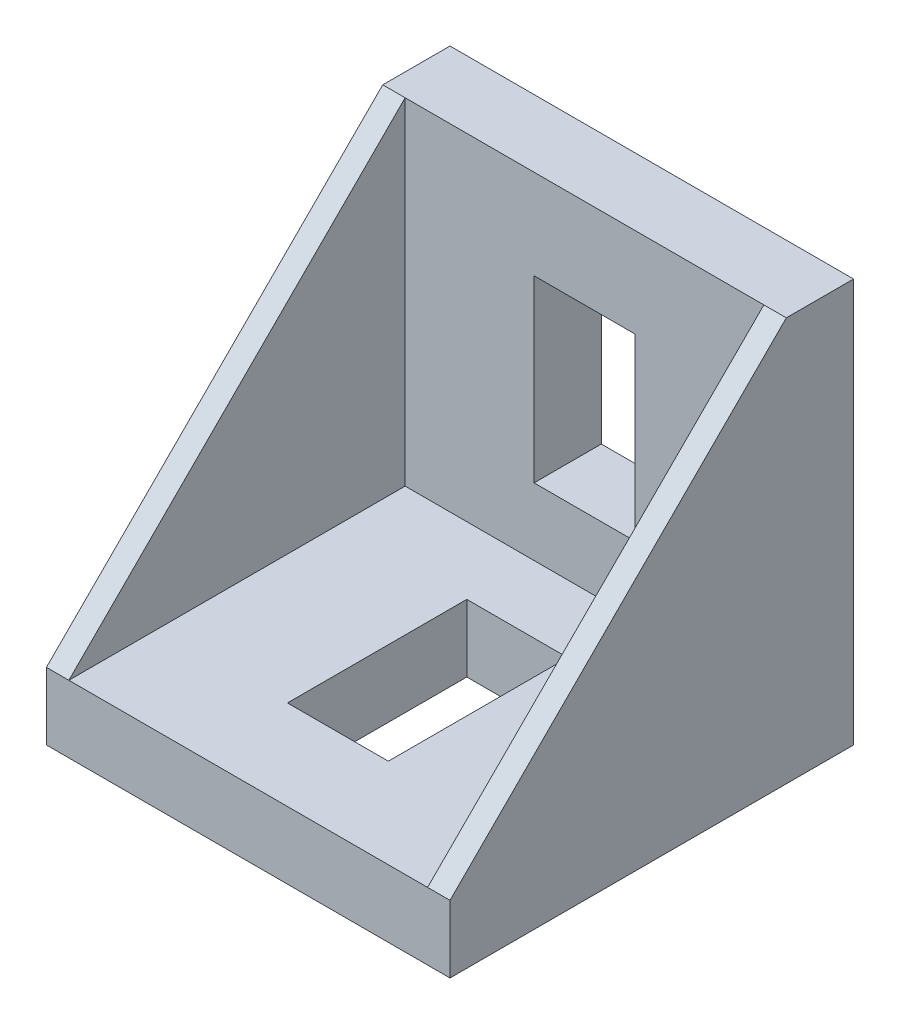
from build123d import *

# Parameters (mm, degrees)
SKETCH1_W           = 18
SKETCH1_H           = 18
BOSS_EXTRUDE1_DEPTH = 3
SKETCH3_W           = 4.5
SKETCH3_H           = 8
CUT_EXTRUDE1_DEPTH  = 14.076696831
SKETCH6_W           = 18
SKETCH6_H           = 3
BOSS_EXTRUDE3_DEPTH = 15
SKETCH7_W           = 4.5
SKETCH7_H           = 8
CUT_EXTRUDE2_DEPTH  = 28
BOSS_EXTRUDE4_DEPTH = 1
CUT_EXTRUDE3_REACH  = 24.045
SKETCH10_W          = 4.5
SKETCH10_H          = 8


with BuildPart() as part:
    # Sketch1 → Boss-Extrude1 (new body)
    with BuildSketch(Plane(origin=(0, 0, 0), x_dir=(1, 0, 0), z_dir=(0, 1, 0))):
        Rectangle(SKETCH1_W, SKETCH1_H)
    boss_extrude1 = extrude(amount=BOSS_EXTRUDE1_DEPTH)

    # Sketch3 → Cut-Extrude1 (cut, through all)
    with BuildSketch(Plane.XZ):
        with Locations((0, 1)):
            Rectangle(SKETCH3_W, SKETCH3_H)
    extrude(amount=-CUT_EXTRUDE1_DEPTH, mode=Mode.SUBTRACT)

    # Sketch6 → Boss-Extrude3 (add)
    with BuildSketch(Plane(origin=(0, 3, 0), x_dir=(1, 0, 0), z_dir=(0, 1, 0))):
        with Locations((0, 7.5)):
            Rectangle(SKETCH6_W, SKETCH6_H)
    extrude(amount=BOSS_EXTRUDE3_DEPTH)

    # Sketch7 → Cut-Extrude2 (cut, through all)
    with BuildSketch(Plane(origin=(0, 0, -9), x_dir=(-1, 0, 0), z_dir=(0, 0, -1))):
        with Locations((0, 10)):
            Rectangle(SKETCH7_W, SKETCH7_H)
    extrude(amount=-CUT_EXTRUDE2_DEPTH, mode=Mode.SUBTRACT)

    # Sketch9 → Boss-Extrude4 (add)
    with BuildSketch(Plane.ZY.offset(9)):
        Polygon((-6, 18), (9, 3), (-6, 3), align=None)
    boss_extrude4 = extrude(amount=-BOSS_EXTRUDE4_DEPTH)

    # Mirror1: Boss-Extrude1, Boss-Extrude4 across plane
    add(boss_extrude1.mirror(Plane.ZY))
    add(boss_extrude4.mirror(Plane.ZY))

    # Sketch10 → Cut-Extrude3 (cut, up to next)
    with BuildSketch(Plane.XZ, mode=Mode.PRIVATE) as cut_extrude3_sk1:
        with Locations((0, 1)):
            Rectangle(SKETCH10_W, SKETCH10_H)
    cut_extrude3_tool1 = extrude(cut_extrude3_sk1.sketch, amount=-CUT_EXTRUDE3_REACH, mode=Mode.PRIVATE) & part.part
    add(cut_extrude3_tool1.solids().sort_by_distance((0, 0, 1))[0], mode=Mode.SUBTRACT)


solid = part.part
